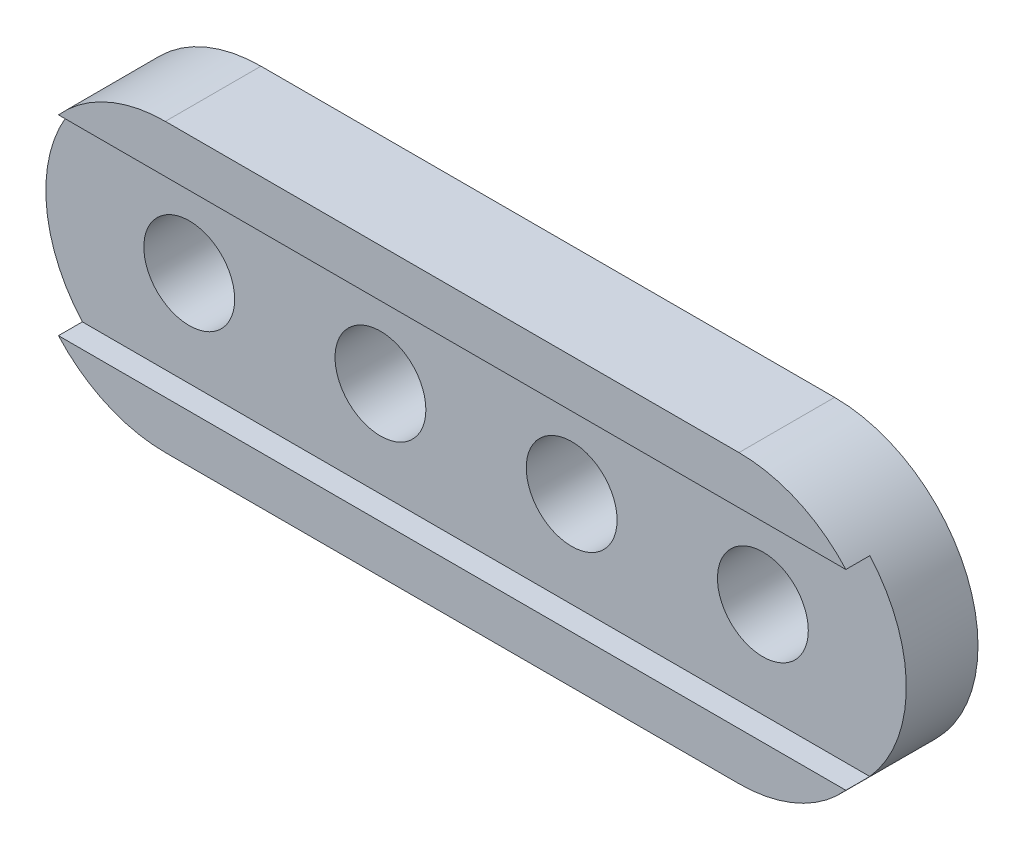
from build123d import *

# Parameters (mm, degrees)
EXTRUDE_1_DEPTH        = 4
SKETCH_2_W             = 36
SKETCH_2_H             = 8
CUT_EXTRUDE_1_DEPTH    = 1
SKETCH_3_R             = 1.9
CUT_EXTRUDE_2_DEPTH    = 3
PATTERN_LINEAR_1_COUNT = 5
PATTERN_LINEAR_1_PITCH = 8


with BuildPart() as part:
    # 草图1 → 凸台-拉伸1 (new body)
    with BuildSketch(Plane.XY):
        with BuildLine():
            Line((-12, 6), (12, 6))
            ThreePointArc((12, 6), (18, 0), (12, -6))
            Line((12, -6), (-12, -6))
            ThreePointArc((-12, -6), (-18, 0), (-12, 6))
        make_face()
    extrude(amount=EXTRUDE_1_DEPTH)

    # 草图2 → 切除-拉伸1 (cut)
    with BuildSketch(Plane.XY.offset(4)):
        Rectangle(SKETCH_2_W, SKETCH_2_H)
    extrude(amount=-CUT_EXTRUDE_1_DEPTH, mode=Mode.SUBTRACT)

    # 草图3 → 切除-拉伸2 (cut)
    with BuildSketch(Plane.XY.offset(3)):
        with Locations((-12, 0)):
            Circle(SKETCH_3_R)
    cut_extrude_2 = extrude(amount=-CUT_EXTRUDE_2_DEPTH, mode=Mode.SUBTRACT)

    # 阵列(线性)1: 切除-拉伸2 ×5
    with Locations(*[(i * PATTERN_LINEAR_1_PITCH, 0, 0) for i in range(1, PATTERN_LINEAR_1_COUNT)]):
        add(cut_extrude_2, mode=Mode.SUBTRACT)


solid = part.part
